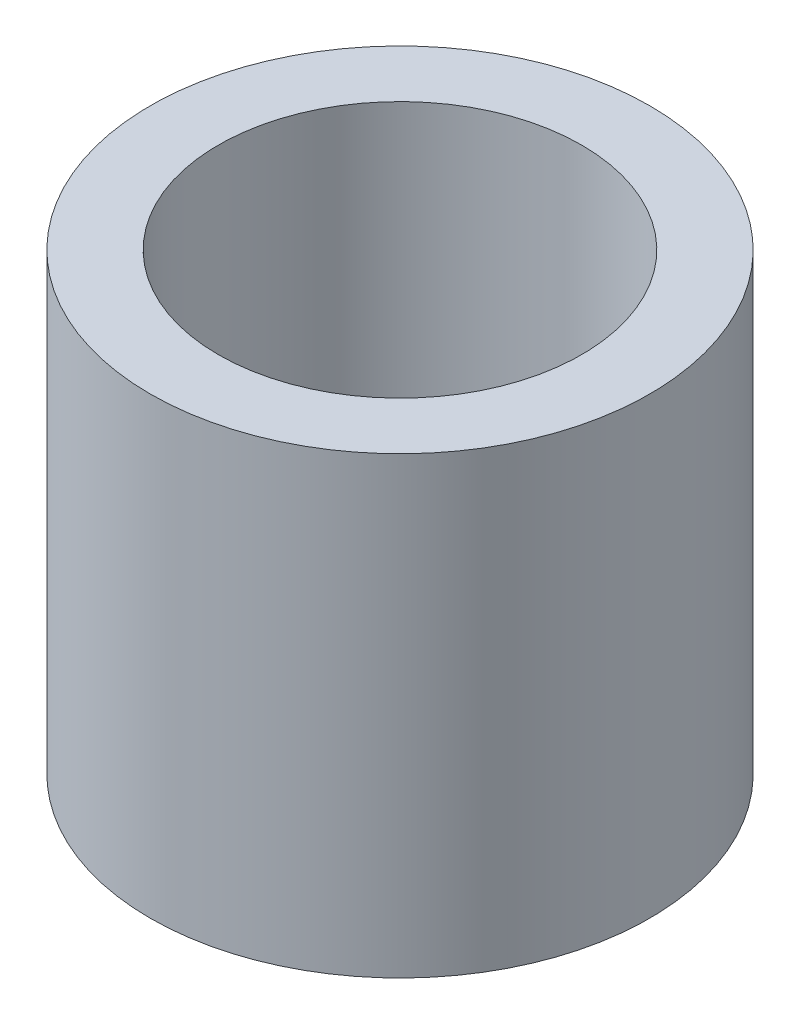
from build123d import *

# Parameters (mm, degrees)
SKETCH1_R           = 5.5
SKETCH1_R_2         = 4
BOSS_EXTRUDE1_DEPTH = 10


with BuildPart() as part:
    # Sketch1 → Boss-Extrude1 (new body)
    with BuildSketch(Plane(origin=(0, 0, 0), x_dir=(1, 0, 0), z_dir=(0, 1, 0))):
        with Locations(Location((0, 0, 0), (0, 0, 270))):
            Circle(SKETCH1_R)
        with Locations(Location((0, 0, 0), (0, 0, 270))):
            Circle(SKETCH1_R_2, mode=Mode.SUBTRACT)
    extrude(amount=BOSS_EXTRUDE1_DEPTH)


solid = part.part
